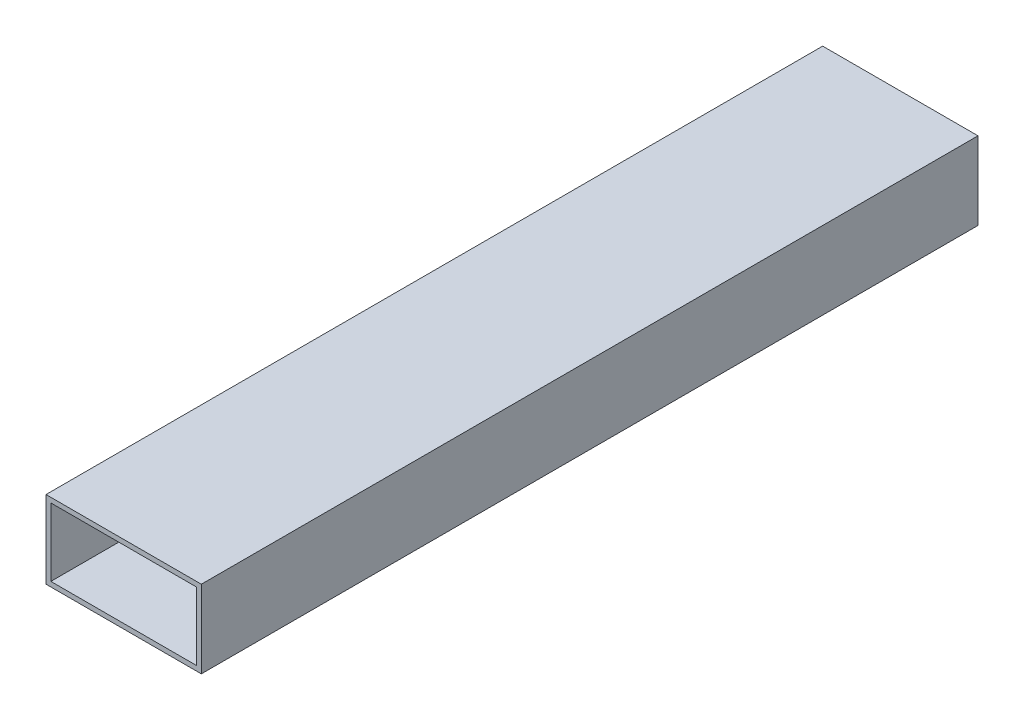
from build123d import *

# Parameters (mm, degrees)
SKETCH1_W           = 50.8
SKETCH1_H           = 25.4
SKETCH1_W_2         = 47.625
SKETCH1_H_2         = 22.225
BOSS_EXTRUDE1_DEPTH = 254


with BuildPart() as part:
    # Sketch1 → Boss-Extrude1 (new body)
    with BuildSketch(Plane.XY):
        Rectangle(SKETCH1_W, SKETCH1_H)
        Rectangle(SKETCH1_W_2, SKETCH1_H_2, mode=Mode.SUBTRACT)
    extrude(amount=BOSS_EXTRUDE1_DEPTH)


solid = part.part
